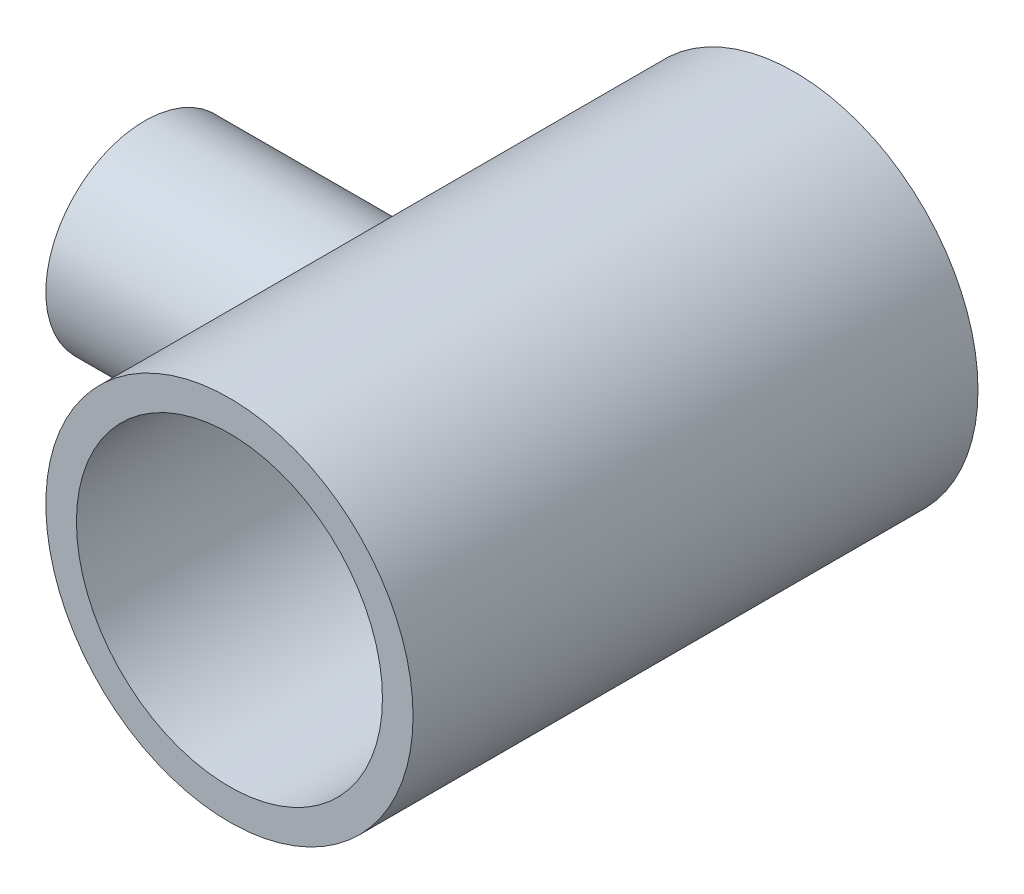
from build123d import *

# Parameters (mm, degrees)
SKETCH1_R           = 24.765
SKETCH1_R_2         = 20.6375
BOSS_EXTRUDE1_DEPTH = 76.2
SKETCH2_R           = 9.525
CUT_EXTRUDE1_DEPTH  = 76.2
SKETCH3_R           = 13.335
SKETCH3_R_2         = 9.525
BOSS_EXTRUDE2_DEPTH = 25.4
BOSS_EXTRUDE3_START = 3.4
SKETCH4_R           = 13.335
SKETCH4_R_2         = 9.525
BOSS_EXTRUDE3_DEPTH = 3.4


with BuildPart() as part:
    # Sketch1 → Boss-Extrude1 (new body)
    with BuildSketch(Plane.XY):
        with Locations(Location((0, 0, 0), (0, 0, 180))):
            Circle(SKETCH1_R)
        with Locations(Location((0, 0, 0), (0, 0, 180))):
            Circle(SKETCH1_R_2, mode=Mode.SUBTRACT)
    extrude(amount=BOSS_EXTRUDE1_DEPTH)

    # Sketch2 → Cut-Extrude1 (cut)
    with BuildSketch(Plane(origin=(0, 0, 0), x_dir=(0, 0, -1), z_dir=(1, 0, 0))):
        with Locations(Location((-38.1, 0, 0), (0, 0, 180))):
            Circle(SKETCH2_R)
    extrude(amount=-CUT_EXTRUDE1_DEPTH, mode=Mode.SUBTRACT)

    # Sketch3 → Boss-Extrude2 (add)
    with BuildSketch(Plane(origin=(-24.13, 0, 0), x_dir=(0, 0, -1), z_dir=(1, 0, 0))):
        with Locations((-38.1, 0)):
            Circle(SKETCH3_R)
        with Locations((-38.1, 0)):
            Circle(SKETCH3_R_2, mode=Mode.SUBTRACT)
    extrude(amount=-BOSS_EXTRUDE2_DEPTH)

    # Sketch4 → Boss-Extrude3 (add)
    with BuildSketch(Plane(origin=(-24.13, 0, 0), x_dir=(0, 0, -1), z_dir=(1, 0, 0)).offset(BOSS_EXTRUDE3_START)):
        with Locations((-38.1, 0)):
            Circle(SKETCH4_R)
        with Locations((-38.1, 0)):
            Circle(SKETCH4_R_2, mode=Mode.SUBTRACT)
    extrude(amount=-BOSS_EXTRUDE3_DEPTH)


solid = part.part
